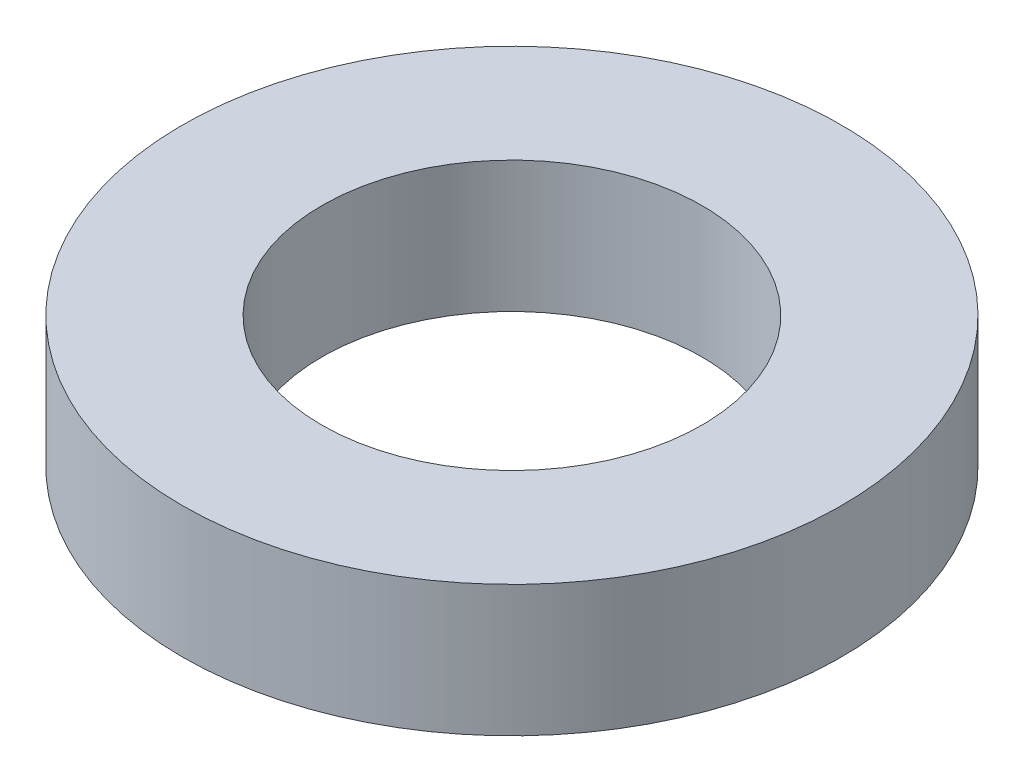
from build123d import *

# Parameters (mm, degrees)
SKETCH1_R           = 16.51
SKETCH1_R_2         = 9.525
BOSS_EXTRUDE1_DEPTH = 6.57


with BuildPart() as part:
    # Sketch1 → Boss-Extrude1 (new body)
    with BuildSketch(Plane(origin=(0, 0, 0), x_dir=(1, 0, 0), z_dir=(0, 1, 0))):
        with Locations(Location((0, 0, 0), (0, 0, 270))):
            Circle(SKETCH1_R)
        with Locations(Location((0, 0, 0), (0, 0, 270))):
            Circle(SKETCH1_R_2, mode=Mode.SUBTRACT)
    extrude(amount=BOSS_EXTRUDE1_DEPTH)


solid = part.part
